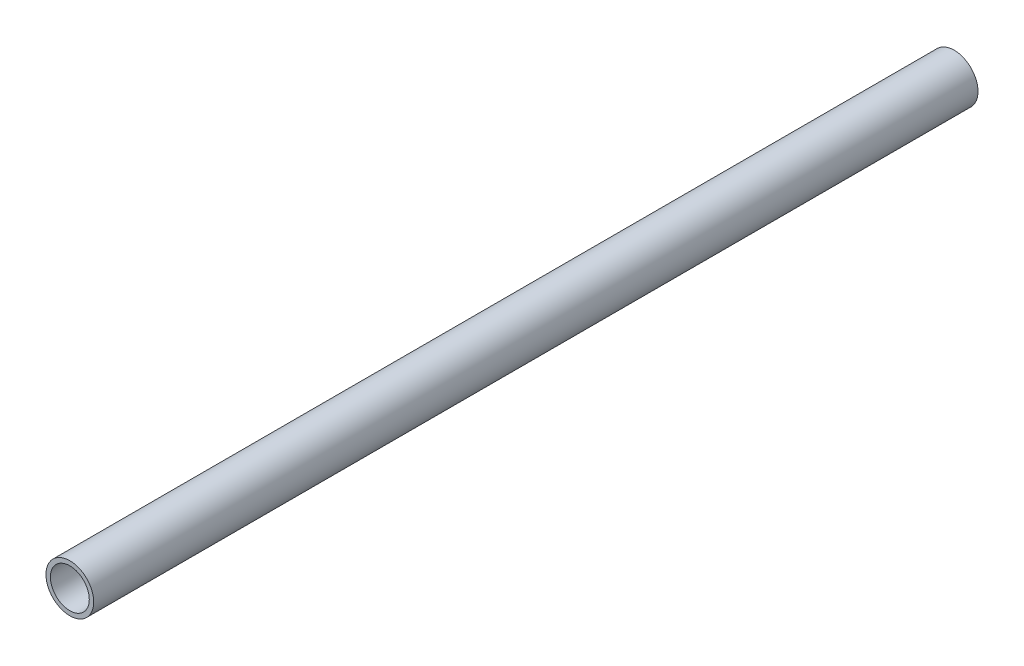
from build123d import *

# Parameters (mm, degrees)
CROQUIS1_R              = 8.1
CROQUIS1_R_2            = 6.6
SALIENTE_EXTRUIR1_DEPTH = 150


with BuildPart() as part:
    # Croquis1 → Saliente-Extruir1 (new, symmetric)
    with BuildSketch(Plane.XY):
        Circle(CROQUIS1_R)
        Circle(CROQUIS1_R_2, mode=Mode.SUBTRACT)
    extrude(amount=SALIENTE_EXTRUIR1_DEPTH, both=True)


solid = part.part
